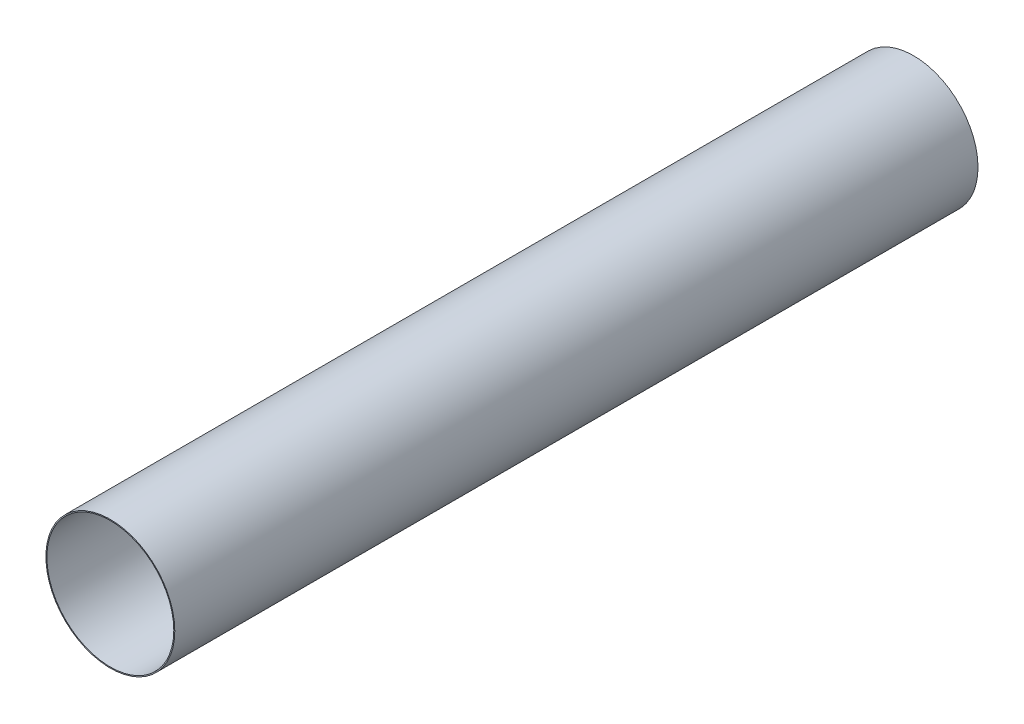
from build123d import *

# Parameters (mm, degrees)
ESQUISSE1_R        = 76.182
ESQUISSE1_R_2      = 75
BOSS_EXTRU_1_DEPTH = 949.3


with BuildPart() as part:
    # Esquisse1 → Boss.-Extru.1 (new body)
    with BuildSketch(Plane.XY):
        Circle(ESQUISSE1_R)
        Circle(ESQUISSE1_R_2, mode=Mode.SUBTRACT)
    extrude(amount=BOSS_EXTRU_1_DEPTH)


solid = part.part
